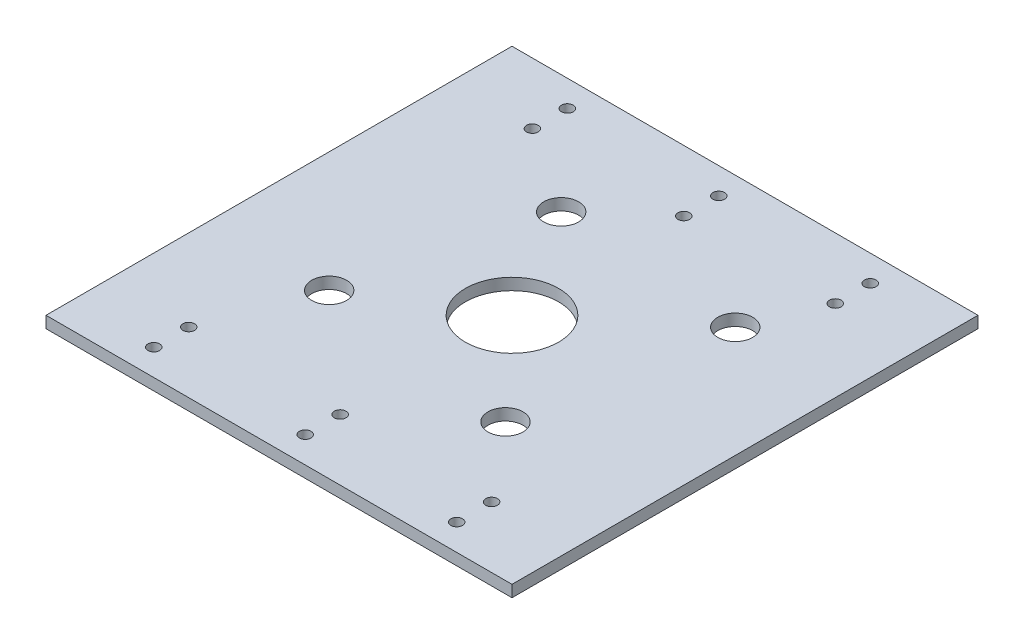
from build123d import *

# Parameters (mm, degrees)
SKETCH2_W              = 200
SKETCH2_H              = 200
BOSS_EXTRUDE1_DEPTH    = 5
SKETCH3_W              = 5
SKETCH3_H              = 30
BOSS_EXTRUDE2_DEPTH    = 60
CUT_EXTRUDE1_REACH     = 189.75
SKETCH4_R              = 5
FILLET1_R              = 10
LPATTERN1_COUNT        = 3
LPATTERN1_PITCH        = 57.5
LPATTERN1_COUNT_DIR2   = 2
LPATTERN1_PITCH_DIR2   = 136.25
FILLET1_OF_LPATTERN1_R = 10
SKETCH6_R              = 20
CUT_EXTRUDE3_DEPTH     = 154.622914957
SKETCH10_R             = 2.5
CUT_EXTRUDE4_DEPTH     = 154.622914957
LPATTERN2_COUNT        = 3
LPATTERN2_PITCH        = 65
LPATTERN2_COUNT_DIR2   = 2
LPATTERN2_PITCH_DIR2   = 162.5
SKETCH11_W             = 200
SKETCH11_H             = 200
CUT_EXTRUDE5_DEPTH     = 154.622914957
SKETCH12_R             = 7.5
CUT_EXTRUDE6_DEPTH     = 142.509716981


with BuildPart() as part:
    # Sketch2 → Boss-Extrude1 (new body)
    with BuildSketch(Plane(origin=(0, 0, 0), x_dir=(1, 0, 0), z_dir=(0, 1, 0))):
        Rectangle(SKETCH2_W, SKETCH2_H)
    extrude(amount=BOSS_EXTRUDE1_DEPTH)

    # Sketch3 → Boss-Extrude2 (add)
    with BuildSketch(Plane(origin=(0, 5, 0), x_dir=(1, 0, 0), z_dir=(0, 1, 0))):
        with Locations((-82.5, 81.25)):
            Rectangle(SKETCH3_W, SKETCH3_H)
        with Locations((-47.5, 81.25)):
            Rectangle(SKETCH3_W, SKETCH3_H)
    boss_extrude2 = extrude(amount=BOSS_EXTRUDE2_DEPTH)

    # Cut-Extrude1: up to this face of the body (flat: up to its plane)
    cut_extrude1_end = Plane(part.part.faces().sort_by_distance((-85, 35, -81.25))[0])
    # Sketch4 → Cut-Extrude1 (cut, up to the picked face)
    with BuildSketch(Plane(origin=(-45, 0, 0), x_dir=(0, 0, -1), z_dir=(1, 0, 0)), mode=Mode.PRIVATE) as cut_extrude1_sk1:
        with Locations((81.25, 55)):
            Circle(SKETCH4_R)
    cut_extrude1_tool1 = split(extrude(cut_extrude1_sk1.sketch, amount=-CUT_EXTRUDE1_REACH, mode=Mode.PRIVATE), bisect_by=cut_extrude1_end, keep=Keep.BOTH, mode=Mode.PRIVATE)
    cut_extrude1 = cut_extrude1_tool1.solids().sort_by(Axis((-45, 55, -81.25), (-1, 0, 0)))[0]
    add(cut_extrude1, mode=Mode.SUBTRACT)

    # Fillet1
    fillet1_edges = [part.edges().sort_by_distance(p)[0] for p in [
        (-82.5, 65, -96.25),
        (-82.5, 65, -66.25),
        (-47.5, 65, -96.25),
        (-47.5, 65, -66.25),
    ]]
    fillet(fillet1_edges, radius=FILLET1_R)

    # LPattern1: Boss-Extrude2, Cut-Extrude1 3 × 2
    with Locations(*[(i * LPATTERN1_PITCH, 0, j * LPATTERN1_PITCH_DIR2) for i in range(LPATTERN1_COUNT) for j in range(LPATTERN1_COUNT_DIR2) if (i, j) != (0, 0)]):
        add(boss_extrude2)
        add(cut_extrude1, mode=Mode.SUBTRACT)

    # Fillet1 of LPattern1
    fillet1_of_lpattern1_edges = [part.edges().sort_by_distance(p)[0] for p in [
        (-82.5, 65, 40),
        (-82.5, 65, 70),
        (-47.5, 65, 40),
        (-47.5, 65, 70),
        (-25, 65, -96.25),
        (-25, 65, -66.25),
        (10, 65, -96.25),
        (10, 65, -66.25),
        (-25, 65, 40),
        (-25, 65, 70),
        (10, 65, 40),
        (10, 65, 70),
        (32.5, 65, -96.25),
        (32.5, 65, -66.25),
        (67.5, 65, -96.25),
        (67.5, 65, -66.25),
        (32.5, 65, 40),
        (32.5, 65, 70),
        (67.5, 65, 40),
        (67.5, 65, 70),
    ]]
    fillet(fillet1_of_lpattern1_edges, radius=FILLET1_OF_LPATTERN1_R)

    # Sketch6 → Cut-Extrude3 (cut, through all)
    with BuildSketch(Plane(origin=(0, 5, 0), x_dir=(1, 0, 0), z_dir=(0, 1, 0))):
        with Locations(Location((0, 0, 0), (0, 0, 270))):
            Circle(SKETCH6_R)
    extrude(amount=-CUT_EXTRUDE3_DEPTH, mode=Mode.SUBTRACT)

    # Sketch10 → Cut-Extrude4 (cut, through all)
    with BuildSketch(Plane(origin=(0, 5, 0), x_dir=(1, 0, 0), z_dir=(0, 1, 0))):
        with Locations(Location((-65, 88.75, 0), (0, 0, 270))):
            Circle(SKETCH10_R)
        with Locations(Location((-65, 73.75, 0), (0, 0, 270))):
            Circle(SKETCH10_R)
    cut_extrude4 = extrude(amount=-CUT_EXTRUDE4_DEPTH, mode=Mode.SUBTRACT)

    # LPattern2: Cut-Extrude4 3 × 2
    with Locations(*[(i * LPATTERN2_PITCH, 0, j * LPATTERN2_PITCH_DIR2) for i in range(LPATTERN2_COUNT) for j in range(LPATTERN2_COUNT_DIR2) if (i, j) != (0, 0)]):
        add(cut_extrude4, mode=Mode.SUBTRACT)

    # Sketch11 → Cut-Extrude5 (cut, through all)
    with BuildSketch(Plane(origin=(0, 5, 0), x_dir=(1, 0, 0), z_dir=(0, 1, 0))):
        Rectangle(SKETCH11_W, SKETCH11_H)
    extrude(amount=CUT_EXTRUDE5_DEPTH, mode=Mode.SUBTRACT)

    # Sketch12 → Cut-Extrude6 (cut, through all)
    with BuildSketch(Plane(origin=(0, 5, 0), x_dir=(1, 0, 0), z_dir=(0, 1, 0))):
        with Locations(Location((-27.889795318, 49.001974117, 0), (0, 0, 270))):
            Circle(SKETCH12_R)
        with Locations(Location((-48.500694077, -29.961353007, 0), (0, 0, 270))):
            Circle(SKETCH12_R)
        with Locations(Location((38.23257582, -41.020077289, 0), (0, 0, 270))):
            Circle(SKETCH12_R)
        with Locations(Location((52.382098498, 43.433800873, 0), (0, 0, 270))):
            Circle(SKETCH12_R)
    extrude(amount=-CUT_EXTRUDE6_DEPTH, mode=Mode.SUBTRACT)


solid = part.part
